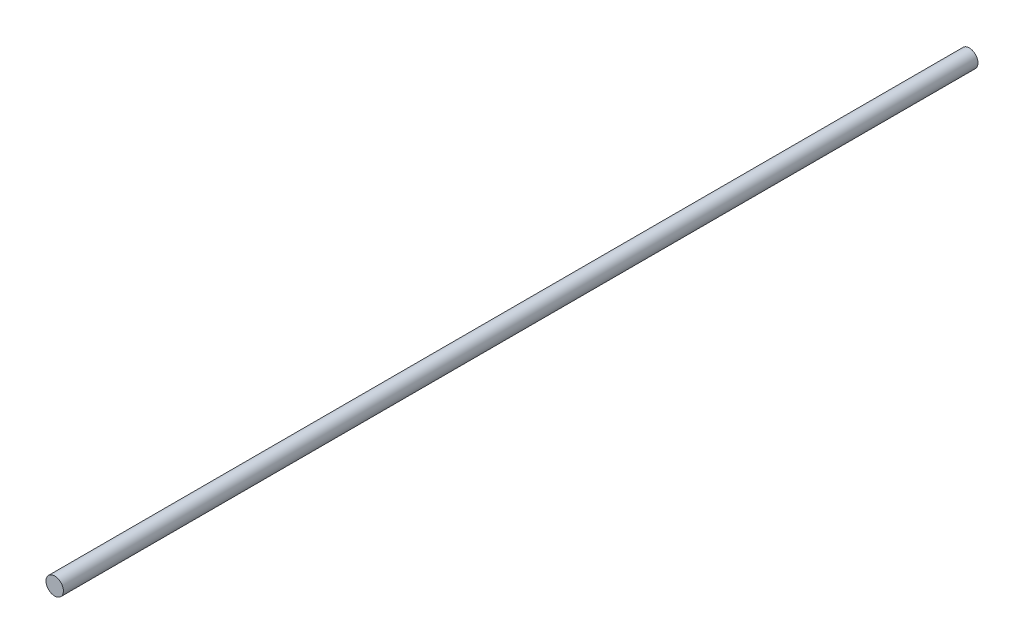
from build123d import *

# Parameters (mm, degrees)
SKETCH1_R           = 20
BOSS_EXTRUDE9_DEPTH = 2100


with BuildPart() as part:
    # Sketch1 → Boss-Extrude9 (new body)
    with BuildSketch(Plane.XY):
        Circle(SKETCH1_R)
    extrude(amount=BOSS_EXTRUDE9_DEPTH)


solid = part.part
